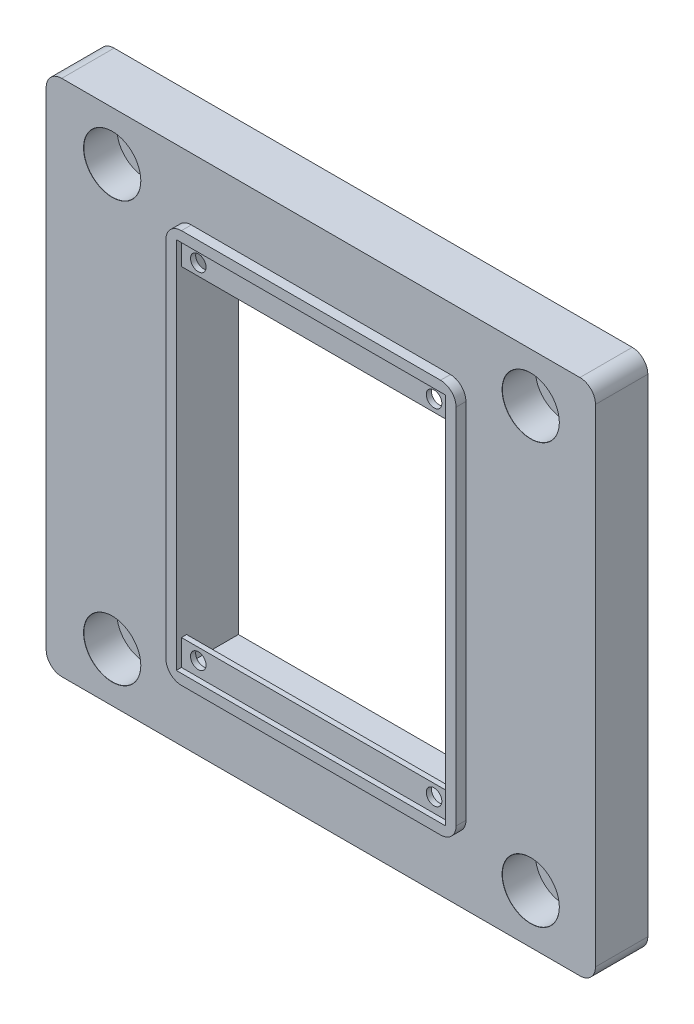
from build123d import *

# Parameters (mm, degrees)
BOSS_EXTRUDE3_DEPTH                          = 10
BOSS_EXTRUDE3_DEPTH_BACK                     = 0.1
SKETCH1_W                                    = 100
SKETCH1_H                                    = 106
SKETCH1_W_2                                  = 76
SKETCH1_H_2                                  = 56
CBORE_FOR_M6_HEX_SOCKET_HEAD_CAP_SCR_2_COUNT = 2
CBORE_FOR_M6_HEX_SOCKET_HEAD_CAP_SCR_2_PITCH = 81
CBORE_FOR_M6_HEX_SOCKET_HEAD_CAP_SCR_3_COUNT = 2
CBORE_FOR_M6_HEX_SOCKET_HEAD_CAP_SCR_3_PITCH = 114.385386776
CBORE_FOR_M6_HEX_SOCKET_HEAD_CAP_SCR_4_COUNT = 2
CBORE_FOR_M6_HEX_SOCKET_HEAD_CAP_SCR_4_PITCH = 80.765194904
SKETCH7_W                                    = 56
SKETCH7_H                                    = 76
BOSS_EXTRUDE4_DEPTH                          = 12
SKETCH8_W                                    = 52
SKETCH8_H                                    = 72
BOSS_EXTRUDE5_DEPTH                          = 1
SKETCH9_W                                    = 52
SKETCH9_H                                    = 72
CUT_EXTRUDE1_DEPTH                           = 1
SKETCH10_W                                   = 52
SKETCH10_H                                   = 62.005454301
CUT_EXTRUDE2_DEPTH                           = 11
SKETCH11_W                                   = 52
SKETCH11_H                                   = 4.999168043
SKETCH11_H_2                                 = 4.995377656
CUT_EXTRUDE3_DEPTH                           = 10
SKETCH12_R                                   = 1.5
CUT_EXTRUDE4_DEPTH                           = 2
SKETCH12_3_R                                 = 1.5
CUT_EXTRUDE5_DEPTH                           = 2
SKETCH14_R                                   = 1.5
CUT_EXTRUDE6_DEPTH                           = 2
SKETCH15_R                                   = 1.5
CUT_EXTRUDE7_DEPTH                           = 2
FILLET2_R                                    = 3


with BuildPart() as part:
    # Sketch1 → Boss-Extrude3 (new, two sides: drawn at the far end of the back side and taken through both)
    with BuildSketch(Plane(origin=(0, 0, 0), x_dir=(0, 1, 0), z_dir=(0, 0, 1)).offset(-BOSS_EXTRUDE3_DEPTH_BACK)):
        with Locations((-4.589836902, -8.848323211)):
            Rectangle(SKETCH1_W, SKETCH1_H)
        with Locations((-4.589836902, -8.848323211)):
            Rectangle(SKETCH1_W_2, SKETCH1_H_2, mode=Mode.SUBTRACT)
    extrude(amount=BOSS_EXTRUDE3_DEPTH + BOSS_EXTRUDE3_DEPTH_BACK)

    # Sketch6 → CBORE for M6 Hex Socket Head Cap Screw2 (revolve, cut)
    with BuildSketch(Plane(origin=(49.348323211, -45.089836902, 10), x_dir=(0, -1, 0), z_dir=(1, 0, 0))):
        Polygon((0, 0), (0, 10.1), (3.3, 10.1), (3.3, 6.4), (5.5, 6.4), (5.5, 0.025), (5.525, 0), align=None)
    cbore_for_m6_hex_socket_head_cap_screw2 = revolve(axis=Axis((49.348323211, -45.089836902, 16.35), (0, 0, -1)), mode=Mode.SUBTRACT)

    # CBORE for M6 Hex Socket Head Cap Scr 2: CBORE for M6 Hex Socket Head Cap Screw2 ×2
    with Locations(*[(0, i * CBORE_FOR_M6_HEX_SOCKET_HEAD_CAP_SCR_2_PITCH, 0) for i in range(1, CBORE_FOR_M6_HEX_SOCKET_HEAD_CAP_SCR_2_COUNT)]):
        add(cbore_for_m6_hex_socket_head_cap_screw2, mode=Mode.SUBTRACT)

    # CBORE for M6 Hex Socket Head Cap Scr 3: CBORE for M6 Hex Socket Head Cap Screw2 ×2
    with Locations(*[Vector(-0.7060796591298035, 0.7081324134391396, 0) * (i * CBORE_FOR_M6_HEX_SOCKET_HEAD_CAP_SCR_3_PITCH) for i in range(1, CBORE_FOR_M6_HEX_SOCKET_HEAD_CAP_SCR_3_COUNT)]):
        add(cbore_for_m6_hex_socket_head_cap_screw2, mode=Mode.SUBTRACT)

    # CBORE for M6 Hex Socket Head Cap Scr 4: CBORE for M6 Hex Socket Head Cap Screw2 ×2
    with Locations(*[(-i * CBORE_FOR_M6_HEX_SOCKET_HEAD_CAP_SCR_4_PITCH, 0, 0) for i in range(1, CBORE_FOR_M6_HEX_SOCKET_HEAD_CAP_SCR_4_COUNT)]):
        add(cbore_for_m6_hex_socket_head_cap_screw2, mode=Mode.SUBTRACT)

    # Sketch7 → Boss-Extrude4 (add)
    with BuildSketch(Plane(origin=(0, 0, -0.1), x_dir=(1, 0, 0), z_dir=(0, 0, -1))):
        with Locations((8.848323211, 4.589836902)):
            Rectangle(SKETCH7_W, SKETCH7_H)
    extrude(amount=-BOSS_EXTRUDE4_DEPTH)

    # Sketch8 → Boss-Extrude5 (add)
    with BuildSketch(Plane.XY.offset(11.9)):
        with Locations((8.848323211, -4.589836902)):
            Rectangle(SKETCH8_W, SKETCH8_H)
    extrude(amount=-BOSS_EXTRUDE5_DEPTH)

    # Sketch9 → Cut-Extrude1 (cut)
    with BuildSketch(Plane.XY.offset(11.9)):
        with Locations((8.848323211, -4.589836902)):
            Rectangle(SKETCH9_W, SKETCH9_H)
    extrude(amount=-CUT_EXTRUDE1_DEPTH, mode=Mode.SUBTRACT)

    # Sketch10 → Cut-Extrude2 (cut)
    with BuildSketch(Plane.XY.offset(10.9)):
        with Locations((8.848323211, -4.587941709)):
            Rectangle(SKETCH10_W, SKETCH10_H)
    extrude(amount=-CUT_EXTRUDE2_DEPTH, mode=Mode.SUBTRACT)

    # Sketch11 → Cut-Extrude3 (cut)
    with BuildSketch(Plane(origin=(0, 0, -0.1), x_dir=(1, 0, 0), z_dir=(0, 0, -1))):
        with Locations((8.848323211, 38.090252881)):
            Rectangle(SKETCH11_W, SKETCH11_H)
        with Locations((8.848323211, -28.91247427)):
            Rectangle(SKETCH11_W, SKETCH11_H_2)
    extrude(amount=-CUT_EXTRUDE3_DEPTH, mode=Mode.SUBTRACT)

    # Sketch12 → Cut-Extrude4 (cut)
    with BuildSketch(Plane.XY.offset(10.9)):
        with Locations((-13.901676789, 28.660163098)):
            Circle(SKETCH12_R)
    extrude(amount=-CUT_EXTRUDE4_DEPTH, mode=Mode.SUBTRACT)

    # Sketch12<3> → Cut-Extrude5 (cut)
    with BuildSketch(Plane.XY.offset(10.9)):
        with Locations((31.598323211, 28.660163098)):
            Circle(SKETCH12_3_R)
    extrude(amount=-CUT_EXTRUDE5_DEPTH, mode=Mode.SUBTRACT)

    # Sketch14 → Cut-Extrude6 (cut)
    with BuildSketch(Plane.XY.offset(10.9)):
        with Locations((-13.901676789, -37.839836902)):
            Circle(SKETCH14_R)
    extrude(amount=-CUT_EXTRUDE6_DEPTH, mode=Mode.SUBTRACT)

    # Sketch15 → Cut-Extrude7 (cut)
    with BuildSketch(Plane.XY.offset(10.9)):
        with Locations((31.598323211, -37.839836902)):
            Circle(SKETCH15_R)
    extrude(amount=-CUT_EXTRUDE7_DEPTH, mode=Mode.SUBTRACT)

    # Fillet2
    fillet2_edges = [part.edges().sort_by_distance(p)[0] for p in [
        (-44.151676789, 45.410163098, 4.95),
        (-19.151676789, 33.410163098, 10.95),
        (36.848323211, 33.410163098, 10.95),
        (61.848323211, 45.410163098, 4.95),
        (36.848323211, -42.589836902, 10.95),
        (61.848323211, -54.589836902, 4.95),
        (-44.151676789, -54.589836902, 4.95),
        (-19.151676789, -42.589836902, 10.95),
    ]]
    fillet(fillet2_edges, radius=FILLET2_R)


solid = part.part
